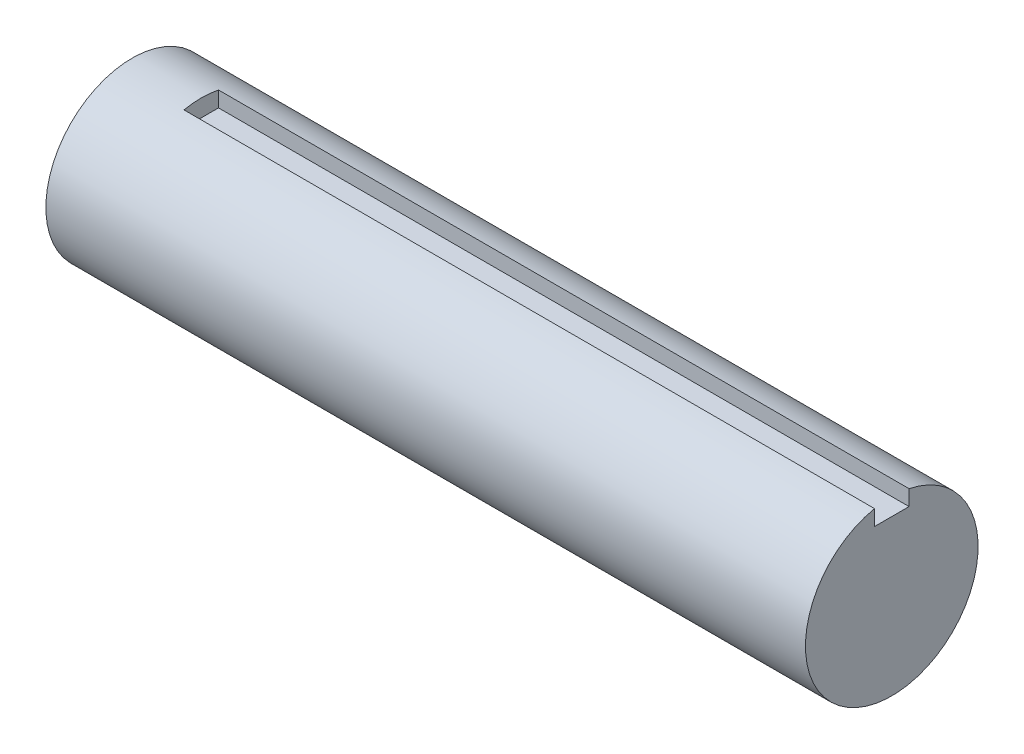
from build123d import *

# Parameters (mm, degrees)
SKETCH1_R           = 38.1
BOSS_EXTRUDE1_DEPTH = 335.28
SKETCH2_W           = 15.24
SKETCH2_H           = 15.24
CUT_EXTRUDE1_DEPTH  = 304.8


with BuildPart() as part:
    # Sketch1 → Boss-Extrude1 (new body)
    with BuildSketch(Plane(origin=(0, 0, 0), x_dir=(0, 0, -1), z_dir=(1, 0, 0))):
        Circle(SKETCH1_R)
    extrude(amount=BOSS_EXTRUDE1_DEPTH)

    # Sketch2 → Cut-Extrude1 (cut)
    with BuildSketch(Plane(origin=(335.28, 0, 0), x_dir=(0, 0, -1), z_dir=(1, 0, 0))):
        with Locations((0, 38.1)):
            Rectangle(SKETCH2_W, SKETCH2_H)
    extrude(amount=-CUT_EXTRUDE1_DEPTH, mode=Mode.SUBTRACT)


solid = part.part
